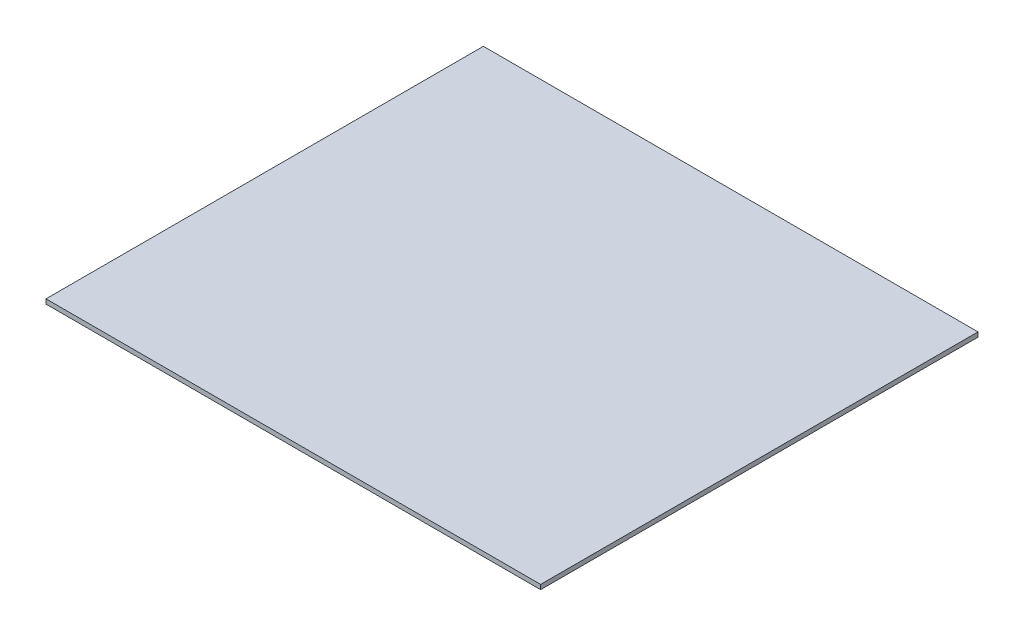
from build123d import *

# Parameters (mm, degrees)
SKETCH1_W           = 685.8
SKETCH1_H           = 606.425
BOSS_EXTRUDE1_DEPTH = 6.35


with BuildPart() as part:
    # Sketch1 → Boss-Extrude1 (new body)
    with BuildSketch(Plane(origin=(0, 0, 0), x_dir=(1, 0, 0), z_dir=(0, 1, 0))):
        with Locations((55.678811881, -68.275074257)):
            Rectangle(SKETCH1_W, SKETCH1_H)
    extrude(amount=BOSS_EXTRUDE1_DEPTH)


solid = part.part
